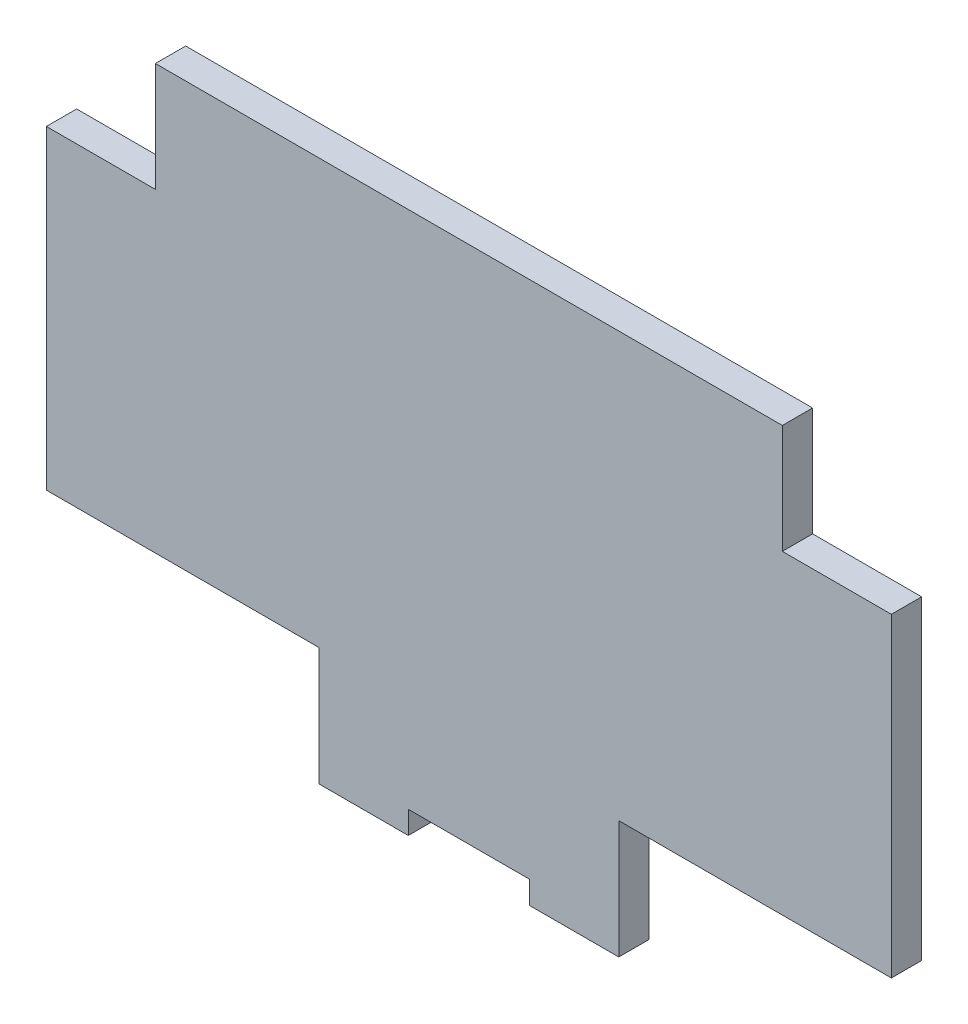
from build123d import *

# Parameters (mm, degrees)
BOSS_EXTRUDE1_DEPTH = 2
SKETCH2_W           = 40
SKETCH2_H           = 13
BOSS_EXTRUDE2_DEPTH = 2.8


with BuildPart() as part:
    # Sketch1 → Boss-Extrude1 (new body)
    with BuildSketch(Plane.XY):
        Polygon((-9.9, -17.9), (-4, -17.9), (-4, -16.4), (4, -16.4), (4, -17.9), (9.9, -17.9), (9.9, -10.1), (27.9, -10.1), (27.9, 10.7), (20.7, 10.7), (20.7, 17.9), (-20.7, 17.9), (-20.7, 10.7), (-27.9, 10.7), (-27.9, -10.1), (-9.9, -10.1), align=None)
    extrude(amount=-BOSS_EXTRUDE1_DEPTH)

    # Sketch2 → Boss-Extrude2 (add)
    with BuildSketch(Plane(origin=(0, 0, -2), x_dir=(-1, 0, 0), z_dir=(0, 0, -1))):
        with Locations((0, -1.7)):
            Rectangle(SKETCH2_W, SKETCH2_H)
    extrude(amount=BOSS_EXTRUDE2_DEPTH)


solid = part.part
